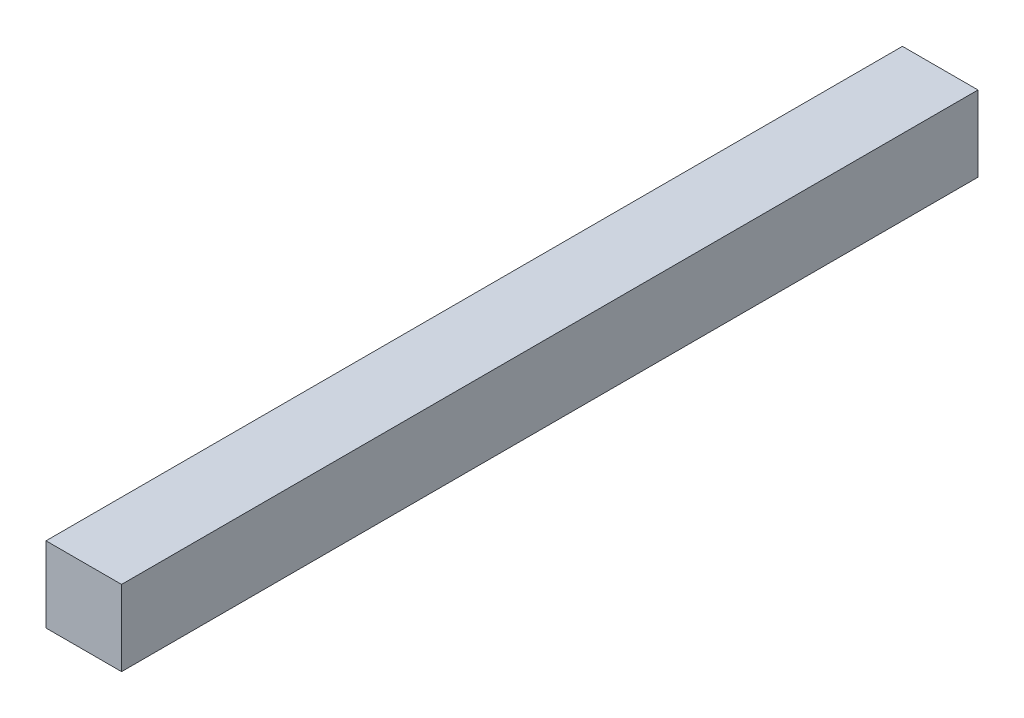
from build123d import *

# Parameters (mm, degrees)
SKETCH_1_W      = 30
SKETCH_1_H      = 30
EXTRUDE_1_DEPTH = 340


with BuildPart() as part:
    # 草图1 → 凸台-拉伸1 (new body)
    with BuildSketch(Plane.XY):
        Rectangle(SKETCH_1_W, SKETCH_1_H)
    extrude(amount=EXTRUDE_1_DEPTH)


solid = part.part
